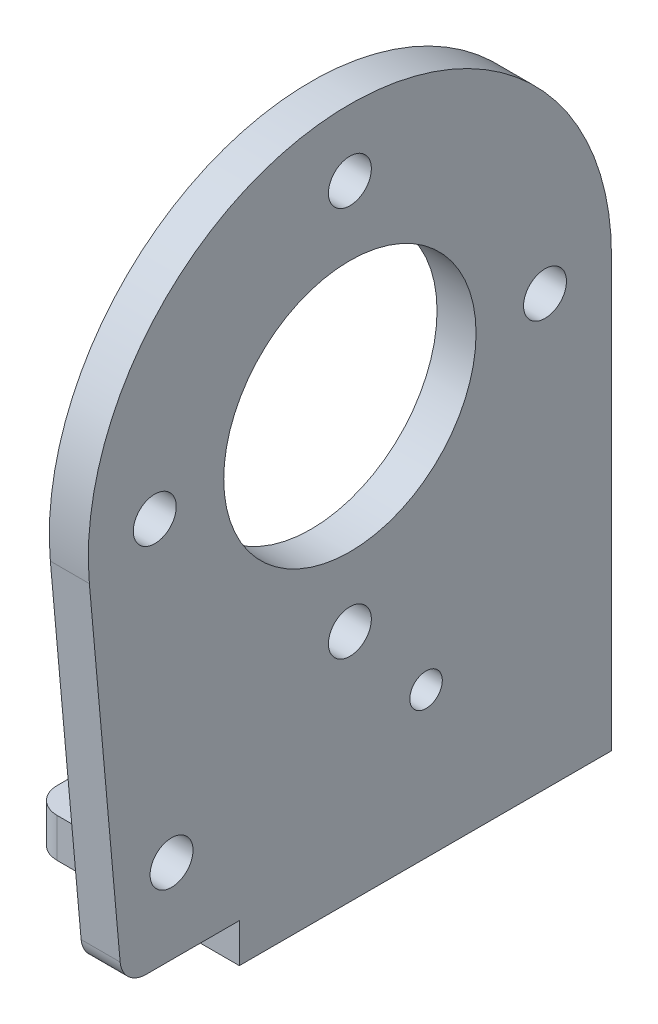
from build123d import *

# Parameters (mm, degrees)
SKETCH_2_W          = 28.61033589
SKETCH_2_H          = 3
EXTRUDE_5_DEPTH     = 16
SKETCH_3_R          = 1.65
CUT_EXTRUDE_1_DEPTH = 10
SKETCH_5_R          = 1.65
SKETCH_5_R_2        = 1.25
SKETCH_5_R_3        = 9.7
EXTRUDE_7_DEPTH     = 3
FILLET_1_R          = 2


with BuildPart() as part:
    # 草图2 → 凸台-拉伸5 (new body)
    with BuildSketch(Plane(origin=(0, 0, 0), x_dir=(0, 0, -1), z_dir=(1, 0, 0))):
        with Locations((23.305167945, 11.5)):
            Rectangle(SKETCH_2_W, SKETCH_2_H)
    extrude(amount=-EXTRUDE_5_DEPTH)

    # 草图3 → 切除-拉伸1 (cut)
    with BuildSketch(Plane(origin=(0, 13, 0), x_dir=(1, 0, 0), z_dir=(0, 1, 0))):
        with Locations(Location((-11.65, 13.6, 0), (0, 0, 270))):
            Circle(SKETCH_3_R)
        with Locations(Location((-11.65, 22.35, 0), (0, 0, 270))):
            Circle(SKETCH_3_R)
        with Locations(Location((-11.65, 31.1, 0), (0, 0, 270))):
            Circle(SKETCH_3_R)
    extrude(amount=-CUT_EXTRUDE_1_DEPTH, mode=Mode.SUBTRACT)

    # 草图5 → 凸台-拉伸7 (add)
    with BuildSketch(Plane(origin=(0, 0, 0), x_dir=(0, 0, -1), z_dir=(1, 0, 0))):
        with BuildLine():
            Line((0, 13), (37.61033589, 13))
            Line((37.61033589, 13), (37.61033589, 42.99965258))
            ThreePointArc((37.61033589, 42.99965258), (16.600372012, 63.090063758), (-2.530280254, 41.20259366))
            Line((-2.530280254, 41.20259366), (0, 13))
        make_face()
        with Locations((17.49980147, 57.99965258)):
            Circle(SKETCH_5_R, mode=Mode.SUBTRACT)
        with Locations((32.49980147, 42.99965258)):
            Circle(SKETCH_5_R, mode=Mode.SUBTRACT)
        with Locations((17.49980147, 27.99965258)):
            Circle(SKETCH_5_R, mode=Mode.SUBTRACT)
        with Locations((2.49980147, 42.99965258)):
            Circle(SKETCH_5_R, mode=Mode.SUBTRACT)
        with Locations((23.354935737, 21.197394906)):
            Circle(SKETCH_5_R_2, mode=Mode.SUBTRACT)
        with Locations((3.788610616, 19.472011044)):
            Circle(SKETCH_5_R, mode=Mode.SUBTRACT)
        with Locations((17.49980147, 42.99965258)):
            Circle(SKETCH_5_R_3, mode=Mode.SUBTRACT)
    extrude(amount=-EXTRUDE_7_DEPTH)

    # 圆角1
    fillet_1_edges = [part.edges().sort_by_distance(p)[0] for p in [
        (-16, 11.5, -37.61033589),
        (-1.5, 13, 0),
        (-16, 11.5, -9),
    ]]
    fillet(fillet_1_edges, radius=FILLET_1_R)


solid = part.part
